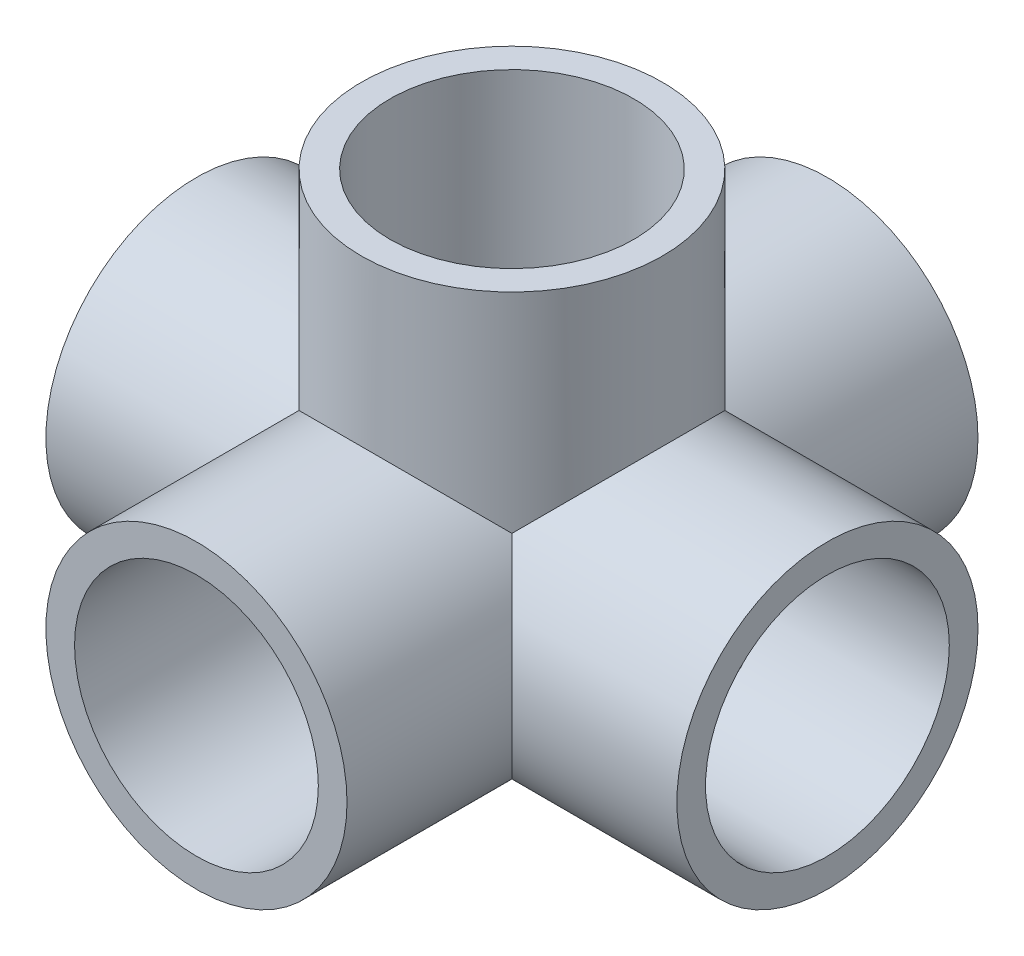
from build123d import *

# Parameters (mm, degrees)
SKETCH1_R               = 16.66875
BOSS_EXTRUDE1_DEPTH     = 69.85
CUT_EXTRUDE1_DEPTH      = 74.720532778
CUT_EXTRUDE1_DEPTH_BACK = 26.9875
SKETCH3_R               = 13.49375
SKETCH4_R               = 16.66875
BOSS_EXTRUDE2_DEPTH     = 34.925
SKETCH5_R               = 12.7
CUT_EXTRUDE2_DEPTH      = 101.179300459
CUT_EXTRUDE8_START      = 19.05
SKETCH11_R              = 13.49375
CUT_EXTRUDE8_DEPTH      = 19.05
CUT_EXTRUDE5_DEPTH      = 80.853774811
CUT_EXTRUDE5_DEPTH_BACK = 80.853774811
SKETCH10_R              = 12.7
SKETCH13_R              = 13.49375
CUT_EXTRUDE9_DEPTH      = 19.05
CUT_EXTRUDE10_START     = -19.05
SKETCH14_R              = 13.49375
CUT_EXTRUDE10_DEPTH     = 19.05
SKETCH15_R              = 16.66875
BOSS_EXTRUDE3_DEPTH     = 34.925
SKETCH17_R              = 13.49375
CUT_EXTRUDE12_DEPTH     = 19.05
SKETCH19_R              = 12.7
CUT_EXTRUDE14_DEPTH     = 105.775000133
SKETCH20_R              = 12.7
CUT_EXTRUDE15_DEPTH     = 86.548429389
SKETCH22_R              = 12.7
CUT_EXTRUDE16_DEPTH     = 30.48


with BuildPart() as part:
    # Sketch1 → Boss-Extrude1 (new body)
    with BuildSketch(Plane.XY):
        Circle(SKETCH1_R)
    extrude(amount=BOSS_EXTRUDE1_DEPTH)

    # Sketch3 → Cut-Extrude1 (cut, two sides: drawn at the far end of the back side and taken through both)
    with BuildSketch(Plane.XY.offset(69.85).offset(-CUT_EXTRUDE1_DEPTH_BACK)):
        with Locations(Location((0, 0, 0), (0, 0, 180))):
            Circle(SKETCH3_R)
    extrude(amount=CUT_EXTRUDE1_DEPTH + CUT_EXTRUDE1_DEPTH_BACK, mode=Mode.SUBTRACT)

    # Sketch4 → Boss-Extrude2 (add, symmetric)
    with BuildSketch(Plane(origin=(0, 0, 0), x_dir=(0, 0, -1), z_dir=(1, 0, 0))):
        with Locations(Location((-34.925, 0, 0), (0, 0, 270))):
            Circle(SKETCH4_R)
    extrude(amount=BOSS_EXTRUDE2_DEPTH, both=True)

    # Sketch5 → Cut-Extrude2 (cut, through all)
    with BuildSketch(Plane(origin=(34.925, 0, 0), x_dir=(0, 0, -1), z_dir=(1, 0, 0))):
        with Locations((-34.925, 0)):
            Circle(SKETCH5_R)
    extrude(amount=-CUT_EXTRUDE2_DEPTH, mode=Mode.SUBTRACT)

    # Sketch11 → Cut-Extrude8 (cut)
    with BuildSketch(Plane.XY.offset(CUT_EXTRUDE8_START)):
        with Locations(Location((0, 0, 0), (0, 0, 180))):
            Circle(SKETCH11_R)
    extrude(amount=-CUT_EXTRUDE8_DEPTH, mode=Mode.SUBTRACT)

    # Sketch10 → Cut-Extrude5 (cut, two sides: drawn at the far end of the back side and taken through both)
    with BuildSketch(Plane.XY.offset(69.85).offset(-CUT_EXTRUDE5_DEPTH_BACK)):
        Circle(SKETCH10_R)
    extrude(amount=CUT_EXTRUDE5_DEPTH + CUT_EXTRUDE5_DEPTH_BACK, mode=Mode.SUBTRACT)

    # Sketch13 → Cut-Extrude9 (cut)
    with BuildSketch(Plane(origin=(34.925, 0, 0), x_dir=(0, 0, -1), z_dir=(1, 0, 0))):
        with Locations((-34.925, 0)):
            Circle(SKETCH13_R)
    extrude(amount=-CUT_EXTRUDE9_DEPTH, mode=Mode.SUBTRACT)

    # Sketch14 → Cut-Extrude10 (cut)
    with BuildSketch(Plane.ZY.offset(34.925).offset(CUT_EXTRUDE10_START)):
        with Locations(Location((34.925, 0, 0), (0, 0, 180))):
            Circle(SKETCH14_R)
    extrude(amount=CUT_EXTRUDE10_DEPTH, mode=Mode.SUBTRACT)

    # Sketch15 → Boss-Extrude3 (add)
    with BuildSketch(Plane(origin=(0, 0, 0), x_dir=(1, 0, 0), z_dir=(0, 1, 0))):
        with Locations(Location((0, -34.925, 0), (0, 0, 107.752790162))):
            Circle(SKETCH15_R)
    extrude(amount=BOSS_EXTRUDE3_DEPTH)

    # Sketch17 → Cut-Extrude12 (cut)
    with BuildSketch(Plane(origin=(0, 34.925, 0), x_dir=(1, 0, 0), z_dir=(0, 1, 0))):
        with Locations(Location((0, -34.925, 0), (0, 0, 270))):
            Circle(SKETCH17_R)
    extrude(amount=-CUT_EXTRUDE12_DEPTH, mode=Mode.SUBTRACT)

    # Sketch19 → Cut-Extrude14 (cut, through all)
    with BuildSketch(Plane(origin=(34.925, 0, 0), x_dir=(0, 0, -1), z_dir=(1, 0, 0))):
        with Locations(Location((-34.925, 0, 0), (0, 0, 66.409614008))):
            Circle(SKETCH19_R)
    extrude(amount=-CUT_EXTRUDE14_DEPTH, mode=Mode.SUBTRACT)

    # Sketch20 → Cut-Extrude15 (cut, through all)
    with BuildSketch(Plane.XY.offset(69.85)):
        with Locations(Location((0, 0, 0), (0, 0, 113.590385992))):
            Circle(SKETCH20_R)
    extrude(amount=-CUT_EXTRUDE15_DEPTH, mode=Mode.SUBTRACT)

    # Sketch22 → Cut-Extrude16 (cut)
    with BuildSketch(Plane(origin=(0, 34.925, 0), x_dir=(1, 0, 0), z_dir=(0, 1, 0))):
        with Locations(Location((0, -34.925, 0), (0, 0, 270))):
            Circle(SKETCH22_R)
    extrude(amount=-CUT_EXTRUDE16_DEPTH, mode=Mode.SUBTRACT)


solid = part.part
